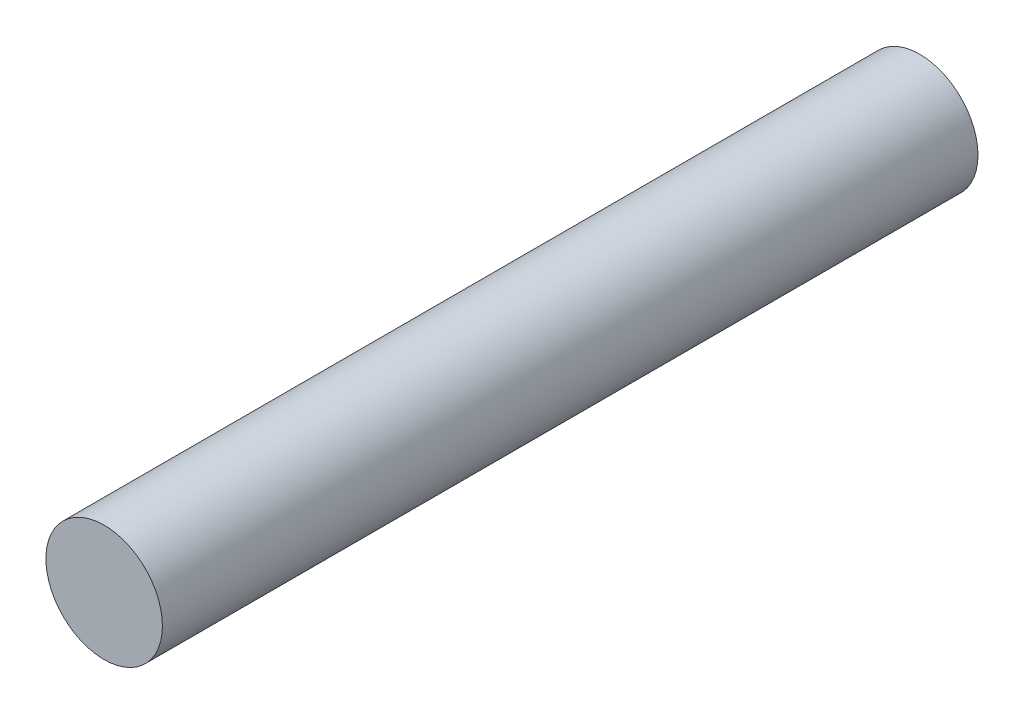
from build123d import *

# Parameters (mm, degrees)
SKETCH1_R           = 2.5
BOSS_EXTRUDE1_DEPTH = 17.5


with BuildPart() as part:
    # Sketch1 → Boss-Extrude1 (new, symmetric)
    with BuildSketch(Plane.XY):
        Circle(SKETCH1_R)
    extrude(amount=BOSS_EXTRUDE1_DEPTH, both=True)


solid = part.part
